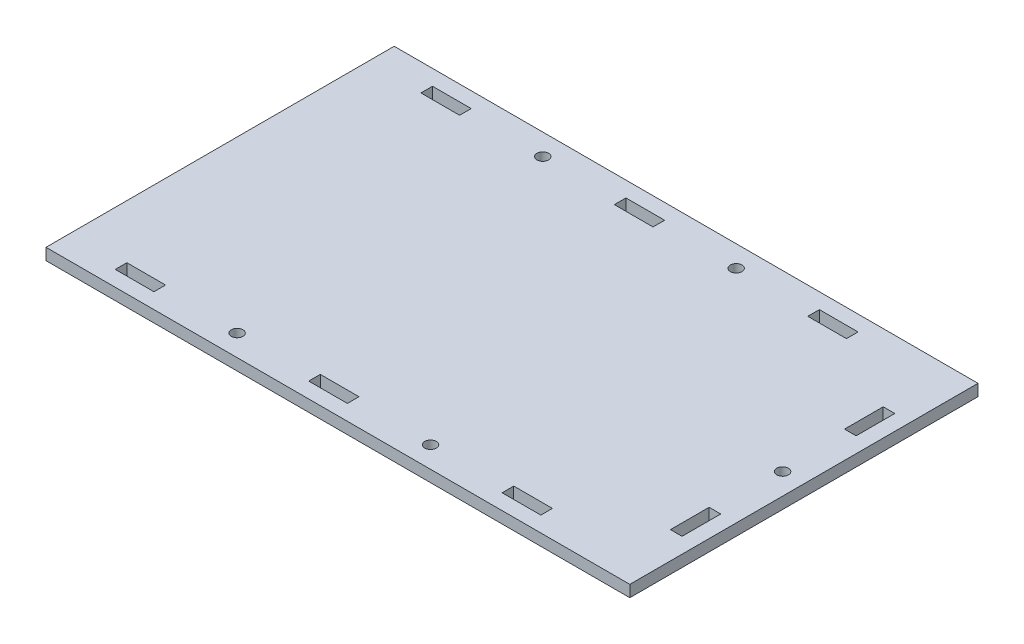
from build123d import *

# Parameters (mm, degrees)
SKETCH1_W           = 150.9
SKETCH1_H           = 90
SKETCH1_R           = 1.5
SKETCH1_W_2         = 10
SKETCH1_H_2         = 3
SKETCH1_W_3         = 3
SKETCH1_H_3         = 10
BOSS_EXTRUDE1_DEPTH = 3


with BuildPart() as part:
    # Sketch1 → Boss-Extrude1 (new body)
    with BuildSketch(Plane(origin=(0, 0, 0), x_dir=(1, 0, 0), z_dir=(0, 1, 0))):
        with Locations((-75.45, 45)):
            Rectangle(SKETCH1_W, SKETCH1_H)
        with Locations(Location((-57, 84.5, 0), (0, 0, 270))):
            Circle(SKETCH1_R, mode=Mode.SUBTRACT)
        with Locations(Location((-107, 84.5, 0), (0, 0, 270))):
            Circle(SKETCH1_R, mode=Mode.SUBTRACT)
        with Locations(Location((-107, 5.5, 0), (0, 0, 90))):
            Circle(SKETCH1_R, mode=Mode.SUBTRACT)
        with Locations(Location((-57, 5.5, 0), (0, 0, 90))):
            Circle(SKETCH1_R, mode=Mode.SUBTRACT)
        with Locations(Location((-5.5, 45, 0), (0, 0, 270))):
            Circle(SKETCH1_R, mode=Mode.SUBTRACT)
        with Locations((-32, 84.5)):
            Rectangle(SKETCH1_W_2, SKETCH1_H_2, mode=Mode.SUBTRACT)
        with Locations((-82, 84.5)):
            Rectangle(SKETCH1_W_2, SKETCH1_H_2, mode=Mode.SUBTRACT)
        with Locations((-132, 84.5)):
            Rectangle(SKETCH1_W_2, SKETCH1_H_2, mode=Mode.SUBTRACT)
        with Locations((-132, 5.5)):
            Rectangle(SKETCH1_W_2, SKETCH1_H_2, mode=Mode.SUBTRACT)
        with Locations((-82, 5.5)):
            Rectangle(SKETCH1_W_2, SKETCH1_H_2, mode=Mode.SUBTRACT)
        with Locations((-32, 5.5)):
            Rectangle(SKETCH1_W_2, SKETCH1_H_2, mode=Mode.SUBTRACT)
        with Locations((-5.5, 67.5)):
            Rectangle(SKETCH1_W_3, SKETCH1_H_3, mode=Mode.SUBTRACT)
        with Locations((-5.5, 22.5)):
            Rectangle(SKETCH1_W_3, SKETCH1_H_3, mode=Mode.SUBTRACT)
    extrude(amount=BOSS_EXTRUDE1_DEPTH)


solid = part.part
